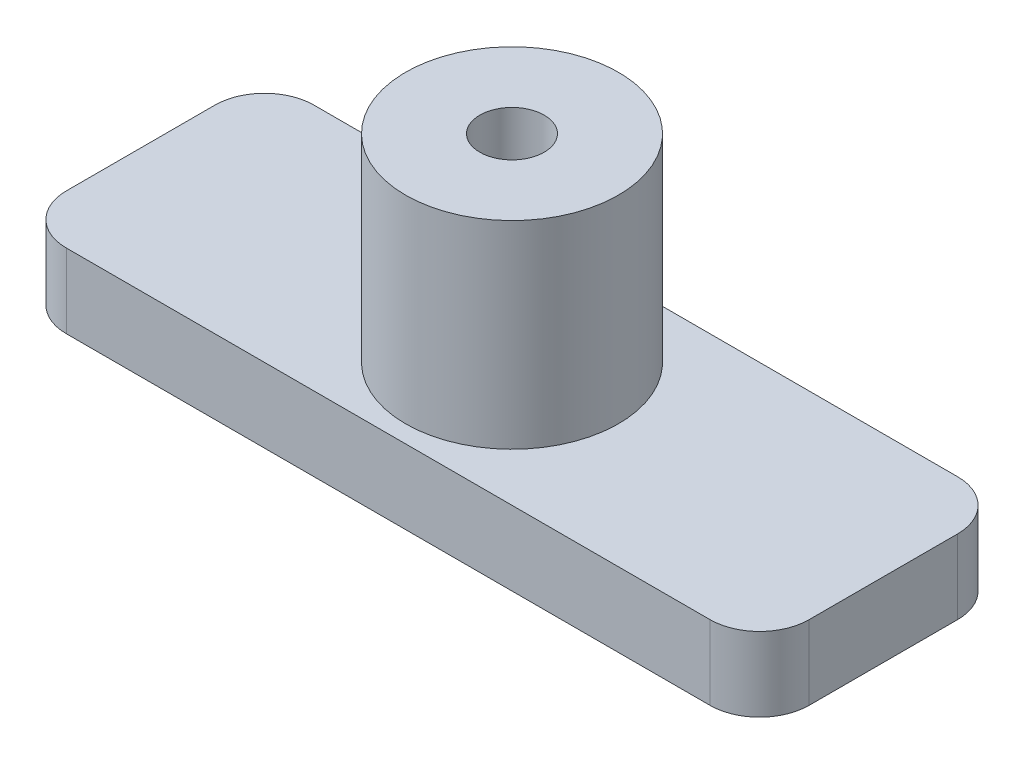
from build123d import *

# Parameters (mm, degrees)
SKETCH1_W           = 30
SKETCH1_H           = 10
BOSS_EXTRUDE1_DEPTH = 3
SKETCH2_R           = 4.3
SKETCH2_R_2         = 1.3
BOSS_EXTRUDE2_DEPTH = 8
FILLET1_R           = 2


with BuildPart() as part:
    # Sketch1 → Boss-Extrude1 (new body)
    with BuildSketch(Plane(origin=(0, 0, 0), x_dir=(1, 0, 0), z_dir=(0, 1, 0))):
        Rectangle(SKETCH1_W, SKETCH1_H)
    extrude(amount=BOSS_EXTRUDE1_DEPTH)

    # Sketch2 → Boss-Extrude2 (add)
    with BuildSketch(Plane(origin=(0, 3, 0), x_dir=(1, 0, 0), z_dir=(0, 1, 0))):
        with Locations(Location((0, 0, 0), (0, 0, 270))):
            Circle(SKETCH2_R)
        with Locations(Location((0, 0, 0), (0, 0, 270))):
            Circle(SKETCH2_R_2, mode=Mode.SUBTRACT)
    extrude(amount=BOSS_EXTRUDE2_DEPTH)

    # Fillet1
    fillet1_edges = [part.edges().sort_by_distance(p)[0] for p in [
        (-15, 1.5, -5),
        (15, 1.5, -5),
        (15, 1.5, 5),
        (-15, 1.5, 5),
    ]]
    fillet(fillet1_edges, radius=FILLET1_R)


solid = part.part
